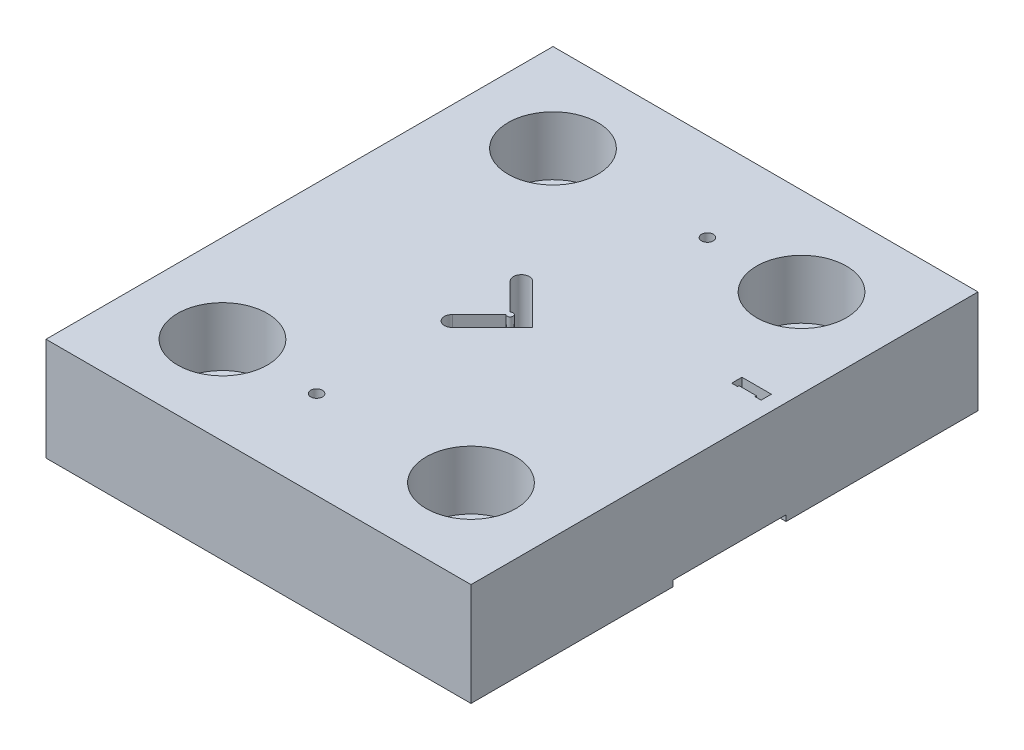
from build123d import *

# Parameters (mm, degrees)
SKETCH1_W           = 144.5
SKETCH1_H           = 172.38
BOSS_EXTRUDE1_DEPTH = 35
CUT_EXTRUDE1_REACH  = 119.787
SKETCH2_R           = 1.99
SKETCH2_R_2         = 10.5
CUT_EXTRUDE2_DEPTH  = 2
SKETCH4_R           = 15.25
CUT_EXTRUDE3_DEPTH  = 20


with BuildPart() as part:
    # Sketch1 → Boss-Extrude1 (new body)
    with BuildSketch(Plane(origin=(0, 0, 0), x_dir=(1, 0, 0), z_dir=(0, 1, 0))):
        Rectangle(SKETCH1_W, SKETCH1_H)
    extrude(amount=BOSS_EXTRUDE1_DEPTH)

    # Sketch2 → Cut-Extrude1 (cut, up to next)
    with BuildSketch(Plane.XZ, mode=Mode.PRIVATE) as cut_extrude1_sk1:
        with Locations(Location((10.25, -56.19, 0), (0, 0, 270))):
            Circle(SKETCH2_R)
    cut_extrude1_tool1 = extrude(cut_extrude1_sk1.sketch, amount=-CUT_EXTRUDE1_REACH, mode=Mode.PRIVATE) & part.part
    # Sketch2 → Cut-Extrude1 (cut, up to next)
    with BuildSketch(Plane.XZ, mode=Mode.PRIVATE) as cut_extrude1_sk2:
        with Locations(Location((-42.25, -56.19, 0), (0, 0, 270))):
            Circle(SKETCH2_R_2)
    cut_extrude1_tool2 = extrude(cut_extrude1_sk2.sketch, amount=-CUT_EXTRUDE1_REACH, mode=Mode.PRIVATE) & part.part
    # Sketch2 → Cut-Extrude1 (cut, up to next)
    with BuildSketch(Plane.XZ, mode=Mode.PRIVATE) as cut_extrude1_sk3:
        with Locations(Location((42.25, -56.19, 0), (0, 0, 270))):
            Circle(SKETCH2_R_2)
    cut_extrude1_tool3 = extrude(cut_extrude1_sk3.sketch, amount=-CUT_EXTRUDE1_REACH, mode=Mode.PRIVATE) & part.part
    # Sketch2 → Cut-Extrude1 (cut, up to next)
    with BuildSketch(Plane.XZ, mode=Mode.PRIVATE) as cut_extrude1_sk4:
        with Locations(Location((-42.25, 56.19, 0), (0, 0, 270))):
            Circle(SKETCH2_R_2)
    cut_extrude1_tool4 = extrude(cut_extrude1_sk4.sketch, amount=-CUT_EXTRUDE1_REACH, mode=Mode.PRIVATE) & part.part
    # Sketch2 → Cut-Extrude1 (cut, up to next)
    with BuildSketch(Plane.XZ, mode=Mode.PRIVATE) as cut_extrude1_sk5:
        with Locations(Location((-10.25, 56.19, 0), (0, 0, 270))):
            Circle(SKETCH2_R)
    cut_extrude1_tool5 = extrude(cut_extrude1_sk5.sketch, amount=-CUT_EXTRUDE1_REACH, mode=Mode.PRIVATE) & part.part
    # Sketch2 → Cut-Extrude1 (cut, up to next)
    with BuildSketch(Plane.XZ, mode=Mode.PRIVATE) as cut_extrude1_sk6:
        with Locations(Location((42.25, 56.19, 0), (0, 0, 270))):
            Circle(SKETCH2_R_2)
    cut_extrude1_tool6 = extrude(cut_extrude1_sk6.sketch, amount=-CUT_EXTRUDE1_REACH, mode=Mode.PRIVATE) & part.part
    # Sketch2 → Cut-Extrude1 (cut, up to next)
    with BuildSketch(Plane.XZ, mode=Mode.PRIVATE) as cut_extrude1_sk7:
        Polygon((57.25, -20.94), (67.25, -20.94), (67.25, -17.44), (65.25, -17.44), (65.25, -17.94), (59.25, -17.94), (59.25, -17.44), (57.25, -17.44), align=None)
    cut_extrude1_tool7 = extrude(cut_extrude1_sk7.sketch, amount=-CUT_EXTRUDE1_REACH, mode=Mode.PRIVATE) & part.part
    # Sketch2 → Cut-Extrude1 (cut, up to next)
    with BuildSketch(Plane.XZ, mode=Mode.PRIVATE) as cut_extrude1_sk8:
        with BuildLine():
            Line((-1.333860018, -0.707106781), (-10.455537495, -9.828784258))
            ThreePointArc((-10.455537495, -9.828784258), (-10.455537495, -13.647160877), (-6.637160877, -13.647160877))
            Line((-6.637160877, -13.647160877), (7.01, 0))
            Line((7.01, 0), (-6.637160877, 13.647160877))
            ThreePointArc((-6.637160877, 13.647160877), (-10.455537495, 13.647160877), (-10.455537495, 9.828784258))
            Line((-10.455537495, 9.828784258), (-1.333860018, 0.707106781))
            ThreePointArc((-1.333860018, 0.707106781), (0.373246763, 0), (-1.333860018, -0.707106781))
        make_face()
    cut_extrude1_tool8 = extrude(cut_extrude1_sk8.sketch, amount=-CUT_EXTRUDE1_REACH, mode=Mode.PRIVATE) & part.part
    add(cut_extrude1_tool1.solids().sort_by_distance((10.25, 0, -56.19))[0], mode=Mode.SUBTRACT)
    add(cut_extrude1_tool2.solids().sort_by_distance((-42.25, 0, -56.19))[0], mode=Mode.SUBTRACT)
    add(cut_extrude1_tool3.solids().sort_by_distance((42.25, 0, -56.19))[0], mode=Mode.SUBTRACT)
    add(cut_extrude1_tool4.solids().sort_by_distance((-42.25, 0, 56.19))[0], mode=Mode.SUBTRACT)
    add(cut_extrude1_tool5.solids().sort_by_distance((-10.25, 0, 56.19))[0], mode=Mode.SUBTRACT)
    add(cut_extrude1_tool6.solids().sort_by_distance((42.25, 0, 56.19))[0], mode=Mode.SUBTRACT)
    add(cut_extrude1_tool7.solids().sort_by_distance((62.25, 0, -19.330625))[0], mode=Mode.SUBTRACT)
    add(cut_extrude1_tool8.solids().sort_by_distance((-0.05515, 0, -6.582011))[0], mode=Mode.SUBTRACT)

    # Sketch3 → Cut-Extrude2 (cut)
    with BuildSketch(Plane.XZ):
        Polygon((-72.25, 17.44), (-72.25, -17.94), (57.25, -17.94), (57.25, -20.94), (72.25, -20.94), (72.25, -19.644727293), (72.25, 17.44), align=None)
    extrude(amount=-CUT_EXTRUDE2_DEPTH, mode=Mode.SUBTRACT)

    # Sketch4 → Cut-Extrude3 (cut)
    with BuildSketch(Plane(origin=(0, 35, 0), x_dir=(1, 0, 0), z_dir=(0, 1, 0))):
        with Locations(Location((-42.25, 56.19, 0), (0, 0, 270))):
            Circle(SKETCH4_R)
        with Locations(Location((42.25, 56.19, 0), (0, 0, 270))):
            Circle(SKETCH4_R)
        with Locations(Location((42.25, -56.19, 0), (0, 0, 270))):
            Circle(SKETCH4_R)
        with Locations(Location((-42.25, -56.19, 0), (0, 0, 270))):
            Circle(SKETCH4_R)
    extrude(amount=-CUT_EXTRUDE3_DEPTH, mode=Mode.SUBTRACT)


solid = part.part
